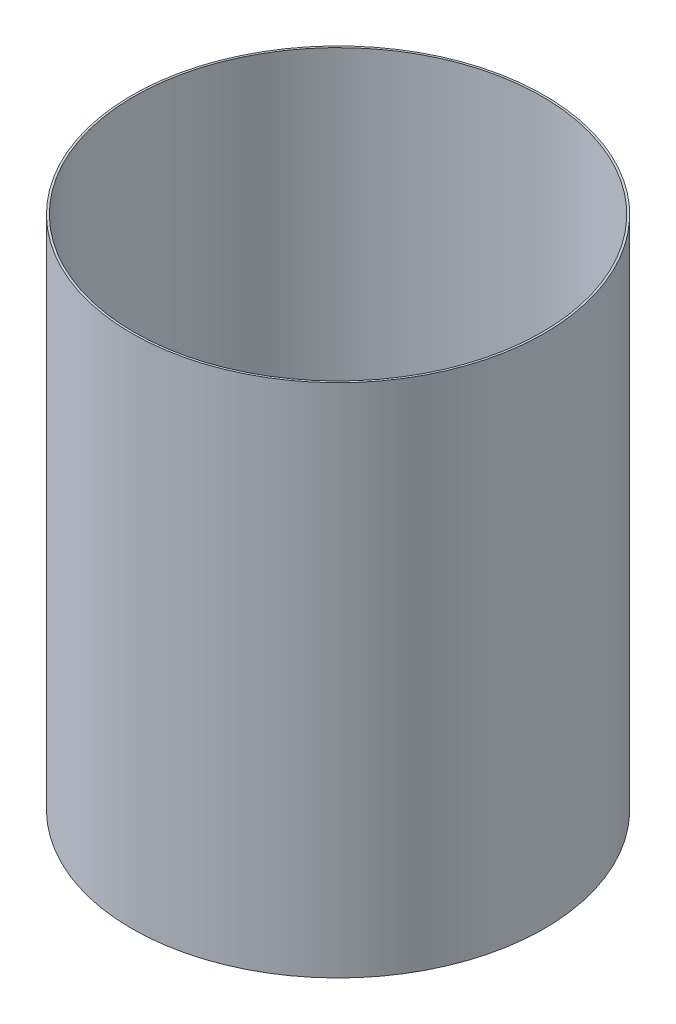
from build123d import *

# Parameters (mm, degrees)
SKETCH1_R           = 10
SKETCH1_R_2         = 9.9
BOSS_EXTRUDE1_DEPTH = 25


with BuildPart() as part:
    # Sketch1 → Boss-Extrude1 (new body)
    with BuildSketch(Plane(origin=(0, 0, 0), x_dir=(1, 0, 0), z_dir=(0, 1, 0))):
        with Locations(Location((0, 0, 0), (0, 0, 270))):
            Circle(SKETCH1_R)
        with Locations(Location((0, 0, 0), (0, 0, 270))):
            Circle(SKETCH1_R_2, mode=Mode.SUBTRACT)
    extrude(amount=BOSS_EXTRUDE1_DEPTH)


solid = part.part
